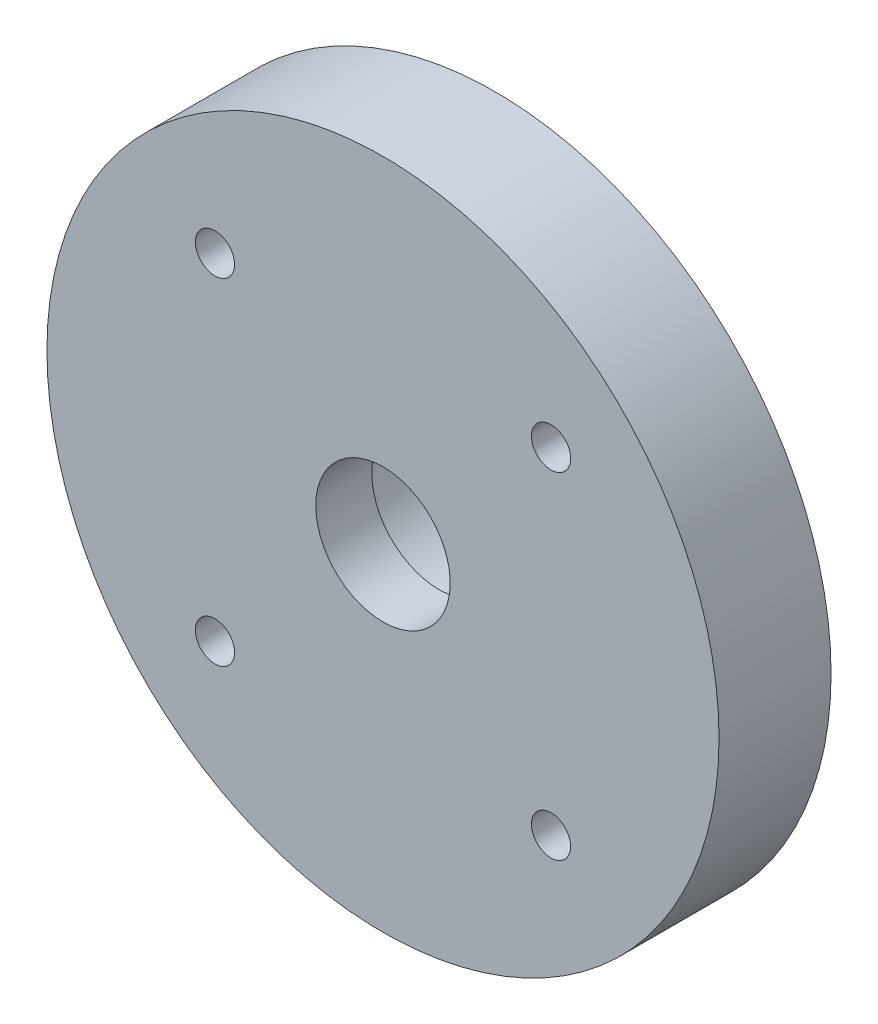
from build123d import *

# Parameters (mm, degrees)
SKETCH1_R           = 30
BOSS_EXTRUDE1_DEPTH = 10
SKETCH2_R           = 6
CUT_EXTRUDE1_DEPTH  = 44.588989435
SKETCH3_R           = 8
CUT_EXTRUDE2_DEPTH  = 5
SKETCH4_R           = 1.75
CUT_EXTRUDE3_DEPTH  = 44.588989435
CUT_EXTRUDE4_DEPTH  = 2


with BuildPart() as part:
    # Sketch1 → Boss-Extrude1 (new body)
    with BuildSketch(Plane.XY):
        Circle(SKETCH1_R)
    extrude(amount=BOSS_EXTRUDE1_DEPTH)

    # Sketch2 → Cut-Extrude1 (cut, through all)
    with BuildSketch(Plane(origin=(0, 0, 0), x_dir=(-1, 0, 0), z_dir=(0, 0, -1))):
        Circle(SKETCH2_R)
    extrude(amount=-CUT_EXTRUDE1_DEPTH, mode=Mode.SUBTRACT)

    # Sketch3 → Cut-Extrude2 (cut)
    with BuildSketch(Plane(origin=(0, 0, 0), x_dir=(-1, 0, 0), z_dir=(0, 0, -1))):
        Circle(SKETCH3_R)
    extrude(amount=-CUT_EXTRUDE2_DEPTH, mode=Mode.SUBTRACT)

    # Sketch4 → Cut-Extrude3 (cut, through all)
    with BuildSketch(Plane(origin=(0, 0, 0), x_dir=(-1, 0, 0), z_dir=(0, 0, -1))):
        with Locations((-15, 15)):
            Circle(SKETCH4_R)
        with Locations(Location((15, 15, 0), (0, 0, 180))):
            Circle(SKETCH4_R)
        with Locations((15, -15)):
            Circle(SKETCH4_R)
        with Locations(Location((-15, -15, 0), (0, 0, 180))):
            Circle(SKETCH4_R)
    extrude(amount=-CUT_EXTRUDE3_DEPTH, mode=Mode.SUBTRACT)

    # Sketch5 → Cut-Extrude4 (cut)
    with BuildSketch(Plane(origin=(0, 0, 0), x_dir=(-1, 0, 0), z_dir=(0, 0, -1))):
        Polygon((-11.709103466, 15), (-13.354551733, 17.85), (-16.645448267, 17.85), (-18.290896534, 15), (-16.645448267, 12.15), (-13.354551733, 12.15), align=None)
        Polygon((13.354551733, 12.15), (11.709103466, 15), (13.354551733, 17.85), (16.645448267, 17.85), (18.290896534, 15), (16.645448267, 12.15), align=None)
        Polygon((11.709103466, -15), (13.354551733, -17.85), (16.645448267, -17.85), (18.290896534, -15), (16.645448267, -12.15), (13.354551733, -12.15), align=None)
        Polygon((-13.354551733, -12.15), (-11.709103466, -15), (-13.354551733, -17.85), (-16.645448267, -17.85), (-18.290896534, -15), (-16.645448267, -12.15), align=None)
    extrude(amount=-CUT_EXTRUDE4_DEPTH, mode=Mode.SUBTRACT)


solid = part.part
